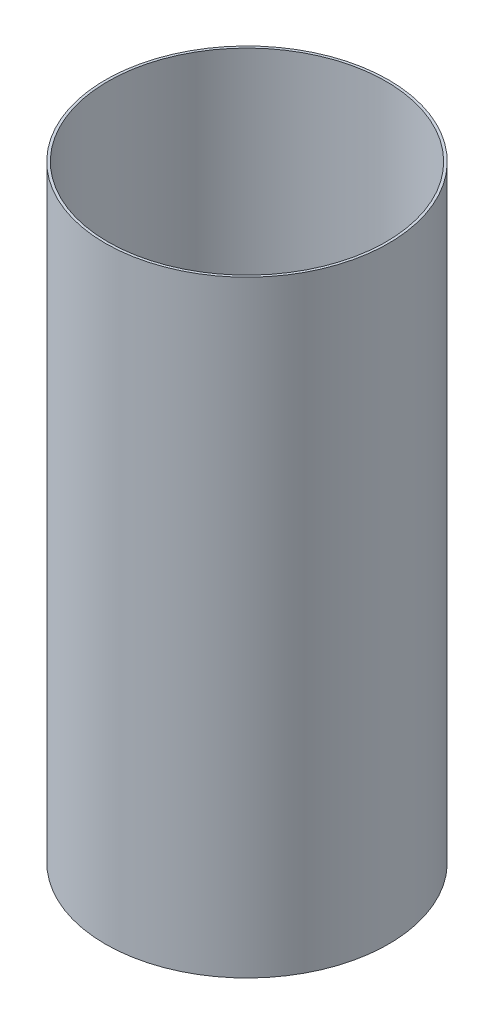
from build123d import *

# Parameters (mm, degrees)
SKETCH2_R           = 560
SKETCH2_R_2         = 550
BOSS_EXTRUDE1_DEPTH = 2400


with BuildPart() as part:
    # Sketch2 → Boss-Extrude1 (new body)
    with BuildSketch(Plane(origin=(0, 0, 0), x_dir=(1, 0, 0), z_dir=(0, 1, 0))):
        with Locations(Location((0, 0, 0), (0, 0, 270))):
            Circle(SKETCH2_R)
        with Locations(Location((0, 0, 0), (0, 0, 270))):
            Circle(SKETCH2_R_2, mode=Mode.SUBTRACT)
    extrude(amount=BOSS_EXTRUDE1_DEPTH)


solid = part.part
